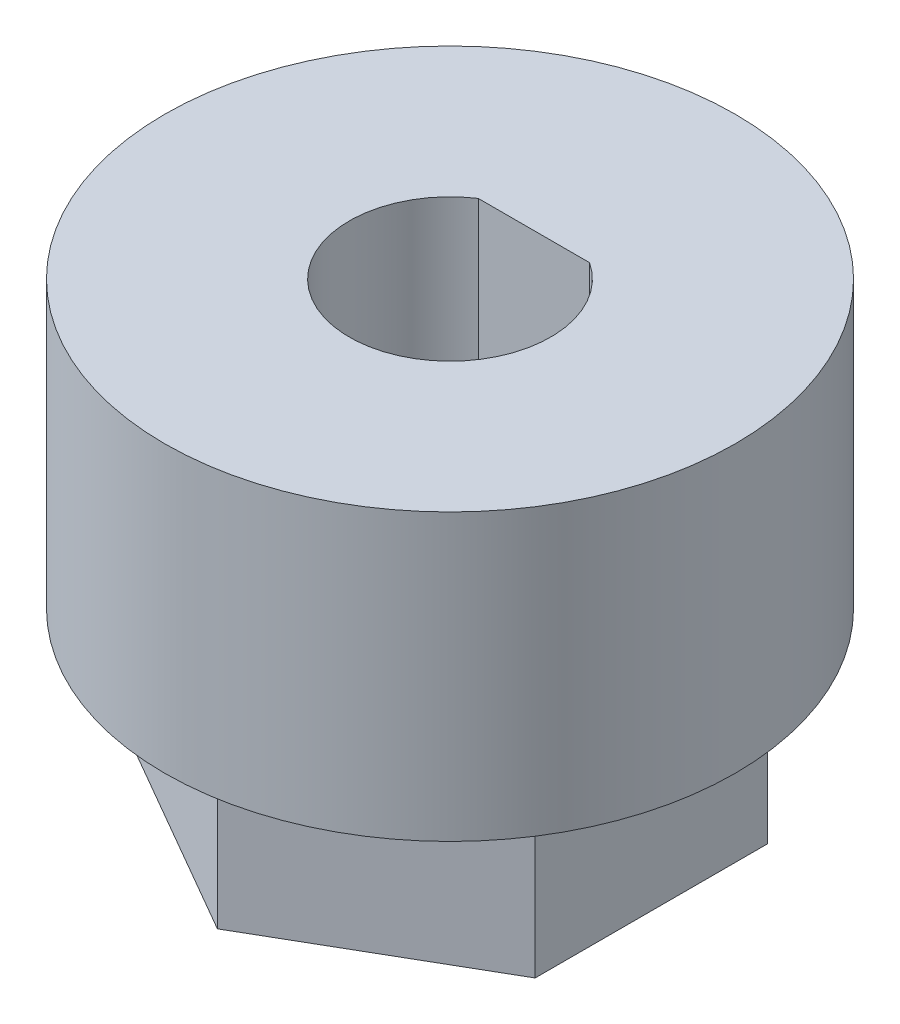
from build123d import *

# Parameters (mm, degrees)
BOSS_EXTRUDE1_DEPTH = 4.8
SKETCH2_R           = 8.5
BOSS_EXTRUDE2_DEPTH = 8.5
CUT_EXTRUDE1_DEPTH  = 18.927353402


with BuildPart() as part:
    # Sketch1 → Boss-Extrude1 (new body)
    with BuildSketch(Plane(origin=(0, 0, 0), x_dir=(1, 0, 0), z_dir=(0, 1, 0))):
        Polygon((-6, 3.464101615), (0, 6.92820323), (6, 3.464101615), (6, -3.464101615), (0, -6.92820323), (-6, -3.464101615), align=None)
    extrude(amount=BOSS_EXTRUDE1_DEPTH)

    # Sketch2 → Boss-Extrude2 (add)
    with BuildSketch(Plane(origin=(0, 4.8, 0), x_dir=(1, 0, 0), z_dir=(0, 1, 0))):
        with Locations(Location((0, 0, 0), (0, 0, 270))):
            Circle(SKETCH2_R)
    extrude(amount=BOSS_EXTRUDE2_DEPTH)

    # Sketch3 → Cut-Extrude1 (cut, through all)
    with BuildSketch(Plane(origin=(0, 13.3, 0), x_dir=(1, 0, 0), z_dir=(0, 1, 0))):
        with BuildLine():
            Line((-1.658312395, 2.5), (1.658312395, 2.5))
            ThreePointArc((1.658312395, 2.5), (0, -3), (-1.658312395, 2.5))
        make_face()
    extrude(amount=-CUT_EXTRUDE1_DEPTH, mode=Mode.SUBTRACT)


solid = part.part
